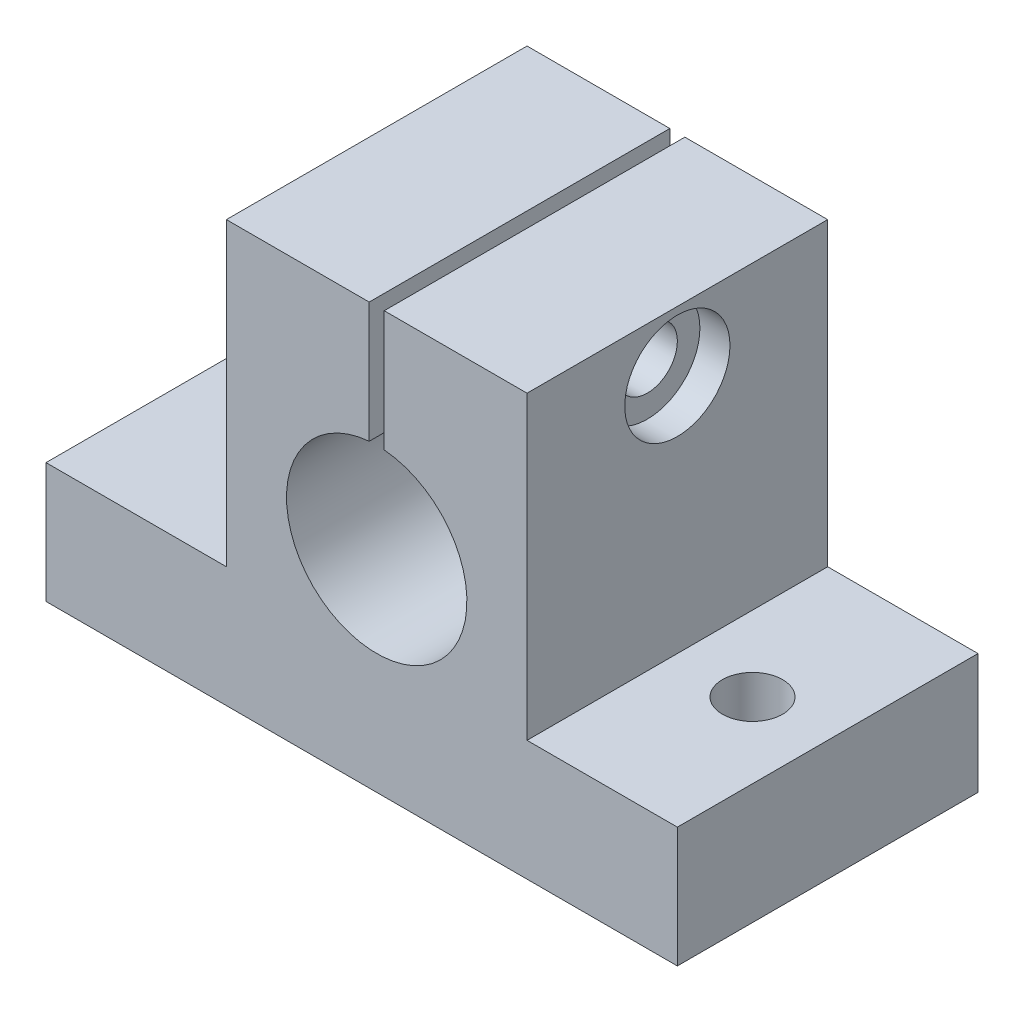
from build123d import *

# Parameters (mm, degrees)
EXTRUDE_1_DEPTH     = 20
SKETCH_4_R          = 2
CUT_EXTRUDE_1_DEPTH = 8
CUT_EXTRUDE_2_REACH = 48.989
SKETCH_5_R          = 2
SKETCH_6_R          = 3.5
CUT_EXTRUDE_3_DEPTH = 2
CUT_EXTRUDE_4_DEPTH = 3


with BuildPart() as part:
    # Эскиз1 → Бобышка-Вытянуть1 (new body)
    with BuildSketch(Plane.XY):
        with BuildLine():
            Line((-22, 0), (20, 0))
            Line((20, 0), (20, 8))
            Line((20, 8), (10, 8))
            Line((10, 8), (10, 28))
            Line((10, 28), (0.5, 28))
            Line((0.5, 28), (0.5, 19.979130372))
            ThreePointArc((0.5, 19.979130372), (0, 8), (-0.5, 19.979130372))
            Line((-0.5, 19.979130372), (-0.5, 28))
            Line((-0.5, 28), (-10, 28))
            Line((-10, 28), (-10, 8))
            Line((-10, 8), (-22, 8))
            Line((-22, 8), (-22, 0))
        make_face()
    extrude(amount=EXTRUDE_1_DEPTH)

    # Эскиз4 → Вырез-Вытянуть1 (cut)
    with BuildSketch(Plane(origin=(0, 8, 0), x_dir=(1, 0, 0), z_dir=(0, 1, 0))):
        with Locations(Location((15, -10, 0), (0, 0, 180))):
            Circle(SKETCH_4_R)
        with Locations(Location((-17, -10, 0), (0, 0, 180))):
            Circle(SKETCH_4_R)
    extrude(amount=-CUT_EXTRUDE_1_DEPTH, mode=Mode.SUBTRACT)

    # Вырез-Вытянуть2: up to this face of the body (flat: up to its plane)
    cut_extrude_2_end = Plane(part.part.faces().sort_by_distance((-10, 18, 10))[0])
    # Эскиз5 → Вырез-Вытянуть2 (cut, up to the picked face)
    with BuildSketch(Plane(origin=(10, 0, 0), x_dir=(0, 0, -1), z_dir=(1, 0, 0)), mode=Mode.PRIVATE) as cut_extrude_2_sk1:
        with Locations((-10, 24)):
            Circle(SKETCH_5_R)
    cut_extrude_2_tool1 = split(extrude(cut_extrude_2_sk1.sketch, amount=-CUT_EXTRUDE_2_REACH, mode=Mode.PRIVATE), bisect_by=cut_extrude_2_end, keep=Keep.BOTH, mode=Mode.PRIVATE)
    add(cut_extrude_2_tool1.solids().sort_by(Axis((10, 24, 10), (-1, 0, 0)))[0], mode=Mode.SUBTRACT)

    # Эскиз6 → Вырез-Вытянуть3 (cut)
    with BuildSketch(Plane(origin=(10, 0, 0), x_dir=(0, 0, -1), z_dir=(1, 0, 0))):
        with Locations((-10, 24)):
            Circle(SKETCH_6_R)
    extrude(amount=-CUT_EXTRUDE_3_DEPTH, mode=Mode.SUBTRACT)

    # Эскиз7 → Вырез-Вытянуть4 (cut)
    with BuildSketch(Plane.ZY.offset(10)):
        Polygon((14.041451884, 24), (12.020725942, 27.5), (7.979274058, 27.5), (5.958548116, 24), (7.979274058, 20.5), (12.020725942, 20.5), align=None)
    extrude(amount=-CUT_EXTRUDE_4_DEPTH, mode=Mode.SUBTRACT)


solid = part.part
